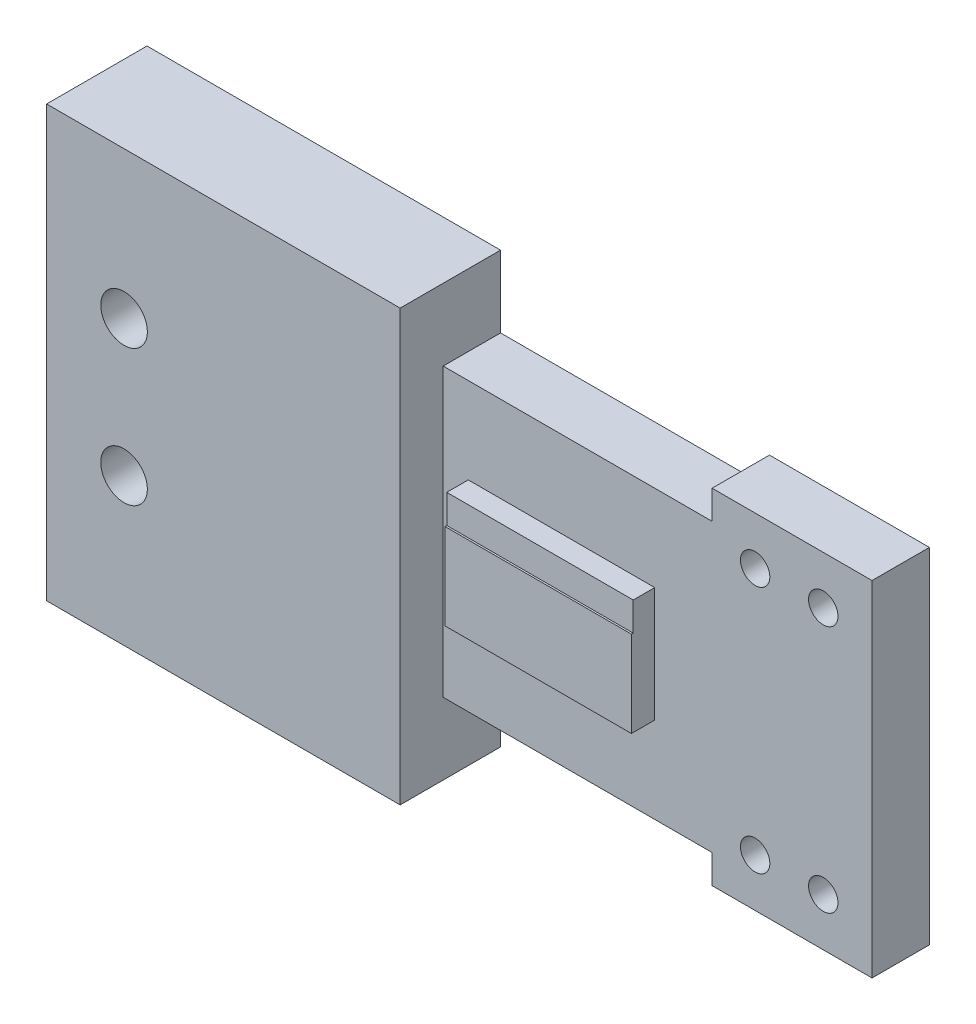
from build123d import *

# Parameters (mm, degrees)
SKETCH1_W           = 109.1
SKETCH1_H           = 40
BOSS_EXTRUDE1_DEPTH = 8
SKETCH2_W           = 22.3
SKETCH2_H           = 48
BOSS_EXTRUDE2_DEPTH = 8
SKETCH3_W           = 49.3
SKETCH3_H           = 60
BOSS_EXTRUDE3_DEPTH = 8
SKETCH4_W           = 49.3
SKETCH4_H           = 60
BOSS_EXTRUDE4_DEPTH = 6
SKETCH5_R           = 3.25
CUT_EXTRUDE1_DEPTH  = 11.1
SKETCH6_R           = 3.25
CUT_EXTRUDE2_DEPTH  = 11.1
SKETCH7_R           = 2.05
CUT_EXTRUDE3_DEPTH  = 6.7
SKETCH8_W           = 26
SKETCH8_H           = 12
BOSS_EXTRUDE5_DEPTH = 3.25
SKETCH9_W           = 26
SKETCH9_H           = 12
BOSS_EXTRUDE6_DEPTH = 3


with BuildPart() as part:
    # Sketch1 → Boss-Extrude1 (new body)
    with BuildSketch(Plane.XY.offset(246)):
        with Locations((281.75, 300)):
            Rectangle(SKETCH1_W, SKETCH1_H)
        with BuildLine():
            Line((290, 296), (290, 304))
            ThreePointArc((290, 304), (288, 306), (286, 304))
            Line((286, 304), (286, 296))
            ThreePointArc((286, 296), (288, 294), (290, 296))
        make_face(mode=Mode.SUBTRACT)
        with BuildLine():
            Line((304, 296), (304, 304))
            ThreePointArc((304, 304), (302, 306), (300, 304))
            Line((300, 304), (300, 296))
            ThreePointArc((300, 296), (302, 294), (304, 296))
        make_face(mode=Mode.SUBTRACT)
    extrude(amount=BOSS_EXTRUDE1_DEPTH)

    # Sketch2 → Boss-Extrude2 (add)
    with BuildSketch(Plane.XY.offset(246)):
        with Locations((325.15, 300)):
            Rectangle(SKETCH2_W, SKETCH2_H)
    extrude(amount=BOSS_EXTRUDE2_DEPTH)

    # Sketch3 → Boss-Extrude3 (add)
    with BuildSketch(Plane.XY.offset(246)):
        with Locations((251.85, 300)):
            Rectangle(SKETCH3_W, SKETCH3_H)
    extrude(amount=BOSS_EXTRUDE3_DEPTH)

    # Sketch4 → Boss-Extrude4 (add)
    with BuildSketch(Plane.XY.offset(254)):
        with Locations((251.85, 300)):
            Rectangle(SKETCH4_W, SKETCH4_H)
    extrude(amount=BOSS_EXTRUDE4_DEPTH)

    # Sketch5 → Cut-Extrude1 (cut)
    with BuildSketch(Plane.XY.offset(248.9)):
        with Locations((238, 290.5)):
            Circle(SKETCH5_R)
        with Locations((238, 309.5)):
            Circle(SKETCH5_R)
    extrude(amount=CUT_EXTRUDE1_DEPTH, mode=Mode.SUBTRACT)

    # Sketch6 → Cut-Extrude2 (cut)
    with BuildSketch(Plane.XY.offset(246)):
        with Locations((252, 281)):
            Circle(SKETCH6_R)
        with Locations((252, 319)):
            Circle(SKETCH6_R)
        with Locations((266, 281)):
            Circle(SKETCH6_R)
        with Locations((266, 319)):
            Circle(SKETCH6_R)
    extrude(amount=CUT_EXTRUDE2_DEPTH, mode=Mode.SUBTRACT)

    # Sketch7 → Cut-Extrude3 (cut)
    with BuildSketch(Plane.XY.offset(247.3)):
        with Locations((320, 282.7)):
            Circle(SKETCH7_R)
        with Locations((320, 317.3)):
            Circle(SKETCH7_R)
        with Locations((329.5, 282.7)):
            Circle(SKETCH7_R)
        with Locations((329.5, 317.3)):
            Circle(SKETCH7_R)
    extrude(amount=CUT_EXTRUDE3_DEPTH, mode=Mode.SUBTRACT)

    # Sketch8 → Boss-Extrude5 (add)
    with BuildSketch(Plane.XY.offset(254)):
        with Locations((293, 298)):
            Rectangle(SKETCH8_W, SKETCH8_H)
    extrude(amount=BOSS_EXTRUDE5_DEPTH)

    # Sketch9 → Boss-Extrude6 (add)
    with BuildSketch(Plane.XY.offset(254)):
        with Locations((293, 302)):
            Rectangle(SKETCH9_W, SKETCH9_H)
    extrude(amount=BOSS_EXTRUDE6_DEPTH)


solid = part.part
